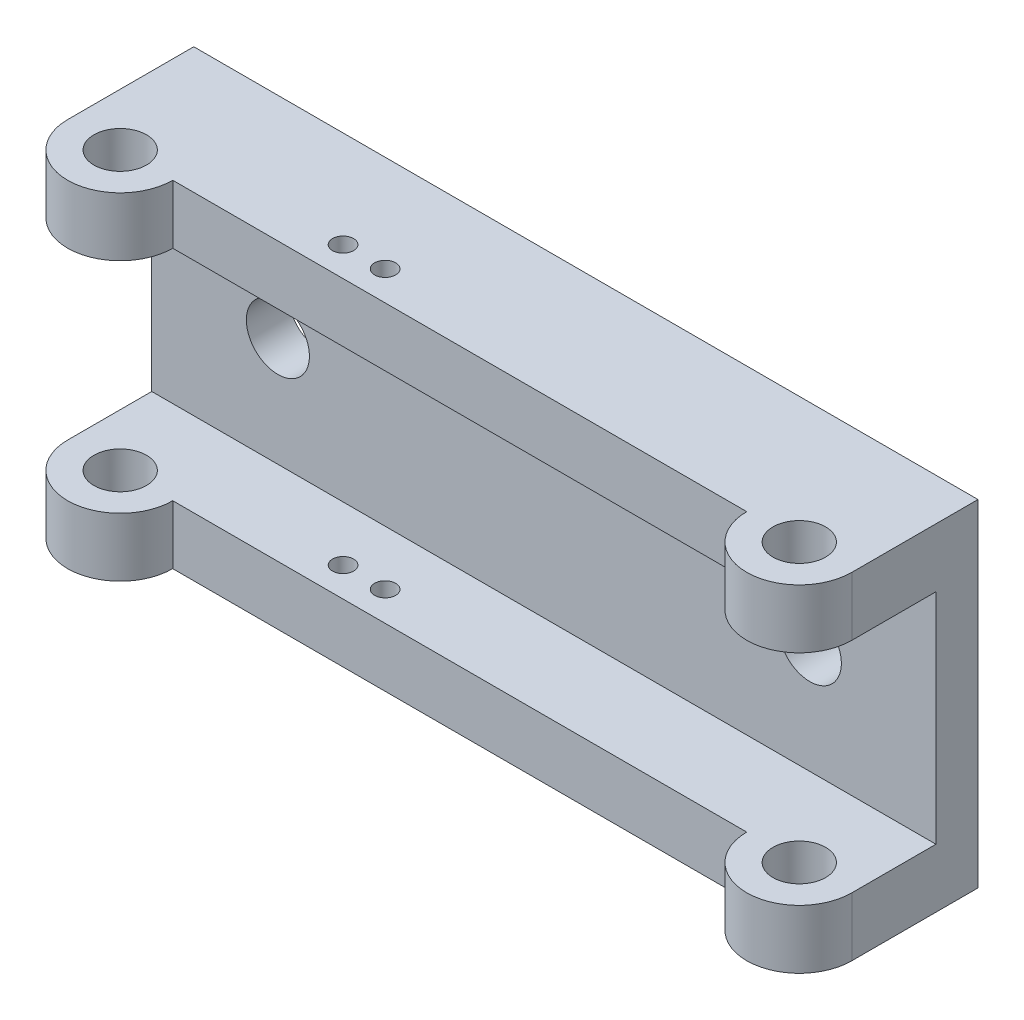
from build123d import *

# Parameters (mm, degrees)
BOSS_EXTRUDE1_DEPTH            = 118.4275
CUT_EXTRUDE1_REACH             = 138.757
SKETCH3_R                      = 3.96875
SKETCH3_R_2                    = 1.5875
CUT_EXTRUDE1_DIRECTION_2_REACH = 138.757
SKETCH4_R                      = 4.7625
CUT_EXTRUDE2_DEPTH             = 6.35


with BuildPart() as part:
    # Sketch2 → Boss-Extrude1 (new body)
    with BuildSketch(Plane(origin=(0, 0, 0), x_dir=(0, 0, -1), z_dir=(1, 0, 0))):
        Polygon((0, -25.4), (0, 25.4), (-63.5, 25.4), (-63.5, 16.51), (-6.35, 16.51), (-6.35, -16.51), (-63.5, -16.51), (-63.5, -25.4), align=None)
    extrude(amount=BOSS_EXTRUDE1_DEPTH)

    # Cut-Extrude1: up to this face of the body (flat: up to its plane)
    cut_extrude1_end = Plane(part.part.faces().sort_by_distance((59.21375, -25.4, 31.75))[0])
    # Sketch3 → Cut-Extrude1 (cut, up to the picked face)
    with BuildSketch(Plane(origin=(0, 0, 0), x_dir=(1, 0, 0), z_dir=(0, 1, 0)), mode=Mode.PRIVATE) as cut_extrude1_sk1:
        with Locations(Location((7.9375, -19.05, 0), (0, 0, 270))):
            Circle(SKETCH3_R)
    cut_extrude1_tool1 = split(extrude(cut_extrude1_sk1.sketch, amount=-CUT_EXTRUDE1_REACH, mode=Mode.PRIVATE), bisect_by=cut_extrude1_end, keep=Keep.BOTH, mode=Mode.PRIVATE)
    # Sketch3 → Cut-Extrude1 (cut, up to the picked face)
    with BuildSketch(Plane(origin=(0, 0, 0), x_dir=(1, 0, 0), z_dir=(0, 1, 0)), mode=Mode.PRIVATE) as cut_extrude1_sk2:
        with Locations(Location((110.49, -19.05, 0), (0, 0, 270))):
            Circle(SKETCH3_R)
    cut_extrude1_tool2 = split(extrude(cut_extrude1_sk2.sketch, amount=-CUT_EXTRUDE1_REACH, mode=Mode.PRIVATE), bisect_by=cut_extrude1_end, keep=Keep.BOTH, mode=Mode.PRIVATE)
    # Sketch3 → Cut-Extrude1 (cut, up to the picked face)
    with BuildSketch(Plane(origin=(0, 0, 0), x_dir=(1, 0, 0), z_dir=(0, 1, 0)), mode=Mode.PRIVATE) as cut_extrude1_sk3:
        with Locations(Location((37.1475, -14.605, 0), (0, 0, 270))):
            Circle(SKETCH3_R_2)
    cut_extrude1_tool3 = split(extrude(cut_extrude1_sk3.sketch, amount=-CUT_EXTRUDE1_REACH, mode=Mode.PRIVATE), bisect_by=cut_extrude1_end, keep=Keep.BOTH, mode=Mode.PRIVATE)
    # Sketch3 → Cut-Extrude1 (cut, up to the picked face)
    with BuildSketch(Plane(origin=(0, 0, 0), x_dir=(1, 0, 0), z_dir=(0, 1, 0)), mode=Mode.PRIVATE) as cut_extrude1_sk4:
        with Locations(Location((43.4975, -14.605, 0), (0, 0, 270))):
            Circle(SKETCH3_R_2)
    cut_extrude1_tool4 = split(extrude(cut_extrude1_sk4.sketch, amount=-CUT_EXTRUDE1_REACH, mode=Mode.PRIVATE), bisect_by=cut_extrude1_end, keep=Keep.BOTH, mode=Mode.PRIVATE)
    # Sketch3 → Cut-Extrude1 (cut, up to the picked face)
    with BuildSketch(Plane(origin=(0, 0, 0), x_dir=(1, 0, 0), z_dir=(0, 1, 0)), mode=Mode.PRIVATE) as cut_extrude1_sk5:
        with BuildLine():
            Line((15.875, -19.05), (102.5525, -19.05))
            ThreePointArc((102.5525, -19.05), (110.49, -26.9875), (118.4275, -19.05))
            Line((118.4275, -19.05), (118.4275, -63.5))
            Line((118.4275, -63.5), (0, -63.5))
            Line((0, -63.5), (0, -19.05))
            ThreePointArc((0, -19.05), (7.9375, -26.9875), (15.875, -19.05))
        make_face()
    cut_extrude1_tool5 = split(extrude(cut_extrude1_sk5.sketch, amount=-CUT_EXTRUDE1_REACH, mode=Mode.PRIVATE), bisect_by=cut_extrude1_end, keep=Keep.BOTH, mode=Mode.PRIVATE)
    add(cut_extrude1_tool1.solids().sort_by(Axis((7.9375, 0, 19.05), (0, -1, 0)))[0], mode=Mode.SUBTRACT)
    add(cut_extrude1_tool2.solids().sort_by(Axis((110.49, 0, 19.05), (0, -1, 0)))[0], mode=Mode.SUBTRACT)
    add(cut_extrude1_tool3.solids().sort_by(Axis((37.1475, 0, 14.605), (0, -1, 0)))[0], mode=Mode.SUBTRACT)
    add(cut_extrude1_tool4.solids().sort_by(Axis((43.4975, 0, 14.605), (0, -1, 0)))[0], mode=Mode.SUBTRACT)
    add(cut_extrude1_tool5.solids().sort_by(Axis((59.21375, 0, 42.011703), (0, -1, 0)))[0], mode=Mode.SUBTRACT)

    # Cut-Extrude1 direction 2: up to this face of the body (flat: up to its plane)
    cut_extrude1_direction_2_end = Plane(part.part.faces().sort_by_distance((59.21375, 25.4, 31.75))[0])
    # Sketch3 → Cut-Extrude1 direction 2 (cut, up to the picked face)
    with BuildSketch(Plane(origin=(0, 0, 0), x_dir=(1, 0, 0), z_dir=(0, 1, 0)), mode=Mode.PRIVATE) as cut_extrude1_direction_2_sk1:
        with Locations(Location((7.9375, -19.05, 0), (0, 0, 270))):
            Circle(SKETCH3_R)
    cut_extrude1_direction_2_tool1 = split(extrude(cut_extrude1_direction_2_sk1.sketch, amount=CUT_EXTRUDE1_DIRECTION_2_REACH, mode=Mode.PRIVATE), bisect_by=cut_extrude1_direction_2_end, keep=Keep.BOTH, mode=Mode.PRIVATE)
    # Sketch3 → Cut-Extrude1 direction 2 (cut, up to the picked face)
    with BuildSketch(Plane(origin=(0, 0, 0), x_dir=(1, 0, 0), z_dir=(0, 1, 0)), mode=Mode.PRIVATE) as cut_extrude1_direction_2_sk2:
        with Locations(Location((110.49, -19.05, 0), (0, 0, 270))):
            Circle(SKETCH3_R)
    cut_extrude1_direction_2_tool2 = split(extrude(cut_extrude1_direction_2_sk2.sketch, amount=CUT_EXTRUDE1_DIRECTION_2_REACH, mode=Mode.PRIVATE), bisect_by=cut_extrude1_direction_2_end, keep=Keep.BOTH, mode=Mode.PRIVATE)
    # Sketch3 → Cut-Extrude1 direction 2 (cut, up to the picked face)
    with BuildSketch(Plane(origin=(0, 0, 0), x_dir=(1, 0, 0), z_dir=(0, 1, 0)), mode=Mode.PRIVATE) as cut_extrude1_direction_2_sk3:
        with Locations(Location((37.1475, -14.605, 0), (0, 0, 270))):
            Circle(SKETCH3_R_2)
    cut_extrude1_direction_2_tool3 = split(extrude(cut_extrude1_direction_2_sk3.sketch, amount=CUT_EXTRUDE1_DIRECTION_2_REACH, mode=Mode.PRIVATE), bisect_by=cut_extrude1_direction_2_end, keep=Keep.BOTH, mode=Mode.PRIVATE)
    # Sketch3 → Cut-Extrude1 direction 2 (cut, up to the picked face)
    with BuildSketch(Plane(origin=(0, 0, 0), x_dir=(1, 0, 0), z_dir=(0, 1, 0)), mode=Mode.PRIVATE) as cut_extrude1_direction_2_sk4:
        with Locations(Location((43.4975, -14.605, 0), (0, 0, 270))):
            Circle(SKETCH3_R_2)
    cut_extrude1_direction_2_tool4 = split(extrude(cut_extrude1_direction_2_sk4.sketch, amount=CUT_EXTRUDE1_DIRECTION_2_REACH, mode=Mode.PRIVATE), bisect_by=cut_extrude1_direction_2_end, keep=Keep.BOTH, mode=Mode.PRIVATE)
    # Sketch3 → Cut-Extrude1 direction 2 (cut, up to the picked face)
    with BuildSketch(Plane(origin=(0, 0, 0), x_dir=(1, 0, 0), z_dir=(0, 1, 0)), mode=Mode.PRIVATE) as cut_extrude1_direction_2_sk5:
        with BuildLine():
            Line((15.875, -19.05), (102.5525, -19.05))
            ThreePointArc((102.5525, -19.05), (110.49, -26.9875), (118.4275, -19.05))
            Line((118.4275, -19.05), (118.4275, -63.5))
            Line((118.4275, -63.5), (0, -63.5))
            Line((0, -63.5), (0, -19.05))
            ThreePointArc((0, -19.05), (7.9375, -26.9875), (15.875, -19.05))
        make_face()
    cut_extrude1_direction_2_tool5 = split(extrude(cut_extrude1_direction_2_sk5.sketch, amount=CUT_EXTRUDE1_DIRECTION_2_REACH, mode=Mode.PRIVATE), bisect_by=cut_extrude1_direction_2_end, keep=Keep.BOTH, mode=Mode.PRIVATE)
    add(cut_extrude1_direction_2_tool1.solids().sort_by(Axis((7.9375, 0, 19.05), (0, 1, 0)))[0], mode=Mode.SUBTRACT)
    add(cut_extrude1_direction_2_tool2.solids().sort_by(Axis((110.49, 0, 19.05), (0, 1, 0)))[0], mode=Mode.SUBTRACT)
    add(cut_extrude1_direction_2_tool3.solids().sort_by(Axis((37.1475, 0, 14.605), (0, 1, 0)))[0], mode=Mode.SUBTRACT)
    add(cut_extrude1_direction_2_tool4.solids().sort_by(Axis((43.4975, 0, 14.605), (0, 1, 0)))[0], mode=Mode.SUBTRACT)
    add(cut_extrude1_direction_2_tool5.solids().sort_by(Axis((59.21375, 0, 42.011703), (0, 1, 0)))[0], mode=Mode.SUBTRACT)

    # Sketch4 → Cut-Extrude2 (cut)
    with BuildSketch(Plane.XY):
        with Locations(Location((19.05, 0, 0), (0, 0, 180))):
            Circle(SKETCH4_R)
        with Locations(Location((99.3775, 0, 0), (0, 0, 180))):
            Circle(SKETCH4_R)
    extrude(amount=CUT_EXTRUDE2_DEPTH, mode=Mode.SUBTRACT)


solid = part.part
